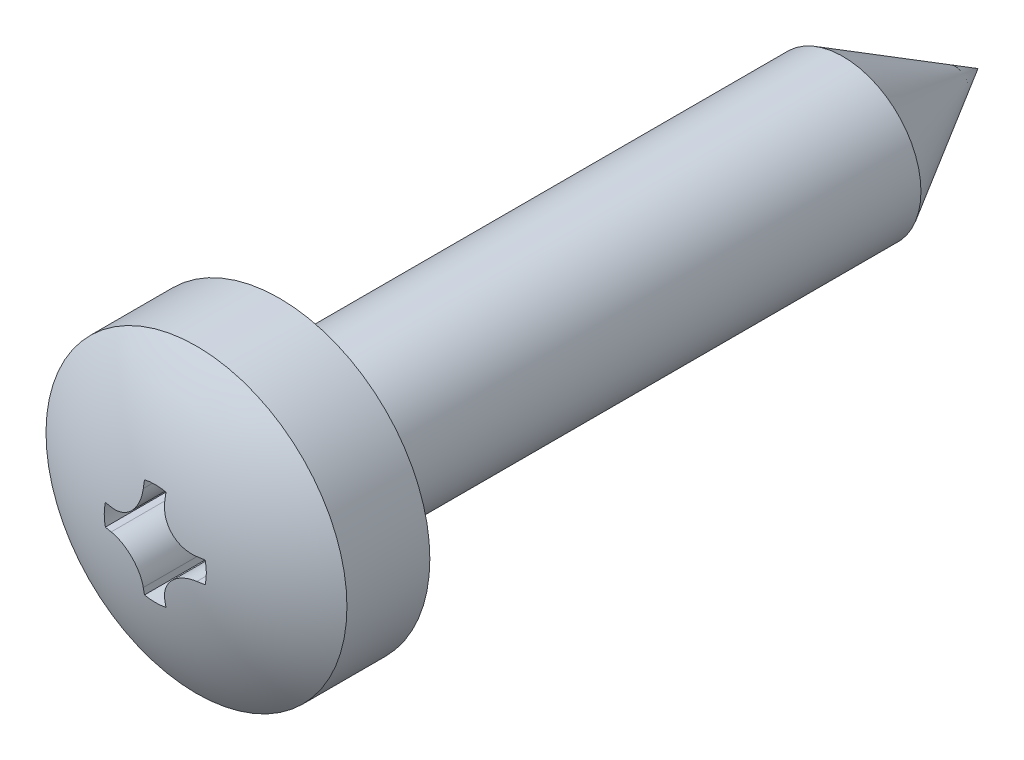
from build123d import *

# Parameters (mm, degrees)
CUT_EXTRUDE_2_DEPTH = 1.2
FILLET_1_R          = 0.1


with BuildPart() as part:
    # 草图8 → Revolve 1380 (revolve)
    with BuildSketch(Plane(origin=(0, 0, 0), x_dir=(0, 0, -1), z_dir=(1, 0, 0)), mode=Mode.PRIVATE) as revolve_1380_sk:
        with BuildLine():
            Line((0, 0), (-15.4, 0))
            ThreePointArc((-15.4, 0), (-15.180811394, 1.464186604), (-14.542463035, 2.8))
            Line((-14.542463035, 2.8), (-13, 2.8))
            Line((-13, 2.8), (-13, 1.45))
            Line((-13, 1.45), (-2.511473671, 1.45))
            Line((-2.511473671, 1.45), (0, 0))
        make_face()
    revolve(revolve_1380_sk.sketch.rotate(Axis((0, 0, 11.71), (0, 0, -1)), 90), axis=Axis((0, 0, 11.71), (0, 0, -1)))

    # 草图7 → 切除-拉伸2 (cut)
    with BuildSketch(Plane.XY.offset(15.4)):
        with BuildLine():
            Line((0.2, 0.928708781), (0.2, 0.797500009))
            ThreePointArc((0.2, 0.797500009), (0.375003701, 0.375003701), (0.797500009, 0.2))
            Line((0.797500009, 0.2), (0.928708781, 0.2))
            ThreePointArc((0.928708781, 0.2), (0.95, 0), (0.928708781, -0.2))
            Line((0.928708781, -0.2), (0.797500009, -0.2))
            ThreePointArc((0.797500009, -0.2), (0.375003701, -0.375003701), (0.2, -0.797500009))
            Line((0.2, -0.797500009), (0.2, -0.928708781))
            ThreePointArc((0.2, -0.928708781), (0, -0.95), (-0.2, -0.928708781))
            Line((-0.2, -0.928708781), (-0.2, -0.797500009))
            ThreePointArc((-0.2, -0.797500009), (-0.375003701, -0.375003701), (-0.797500009, -0.2))
            Line((-0.797500009, -0.2), (-0.928708781, -0.2))
            ThreePointArc((-0.928708781, -0.2), (-0.95, 0), (-0.928708781, 0.2))
            Line((-0.928708781, 0.2), (-0.797500009, 0.2))
            ThreePointArc((-0.797500009, 0.2), (-0.375003701, 0.375003701), (-0.2, 0.797500009))
            Line((-0.2, 0.797500009), (-0.2, 0.928708781))
            ThreePointArc((-0.2, 0.928708781), (0, 0.95), (0.2, 0.928708781))
        make_face()
    extrude(amount=-CUT_EXTRUDE_2_DEPTH, mode=Mode.SUBTRACT)

    # 圆角1
    fillet_1_edges = [part.edges().sort_by_distance(p)[0] for p in [
        (-1.45, 0, 13),
    ]]
    fillet(fillet_1_edges, radius=FILLET_1_R)


solid = part.part
